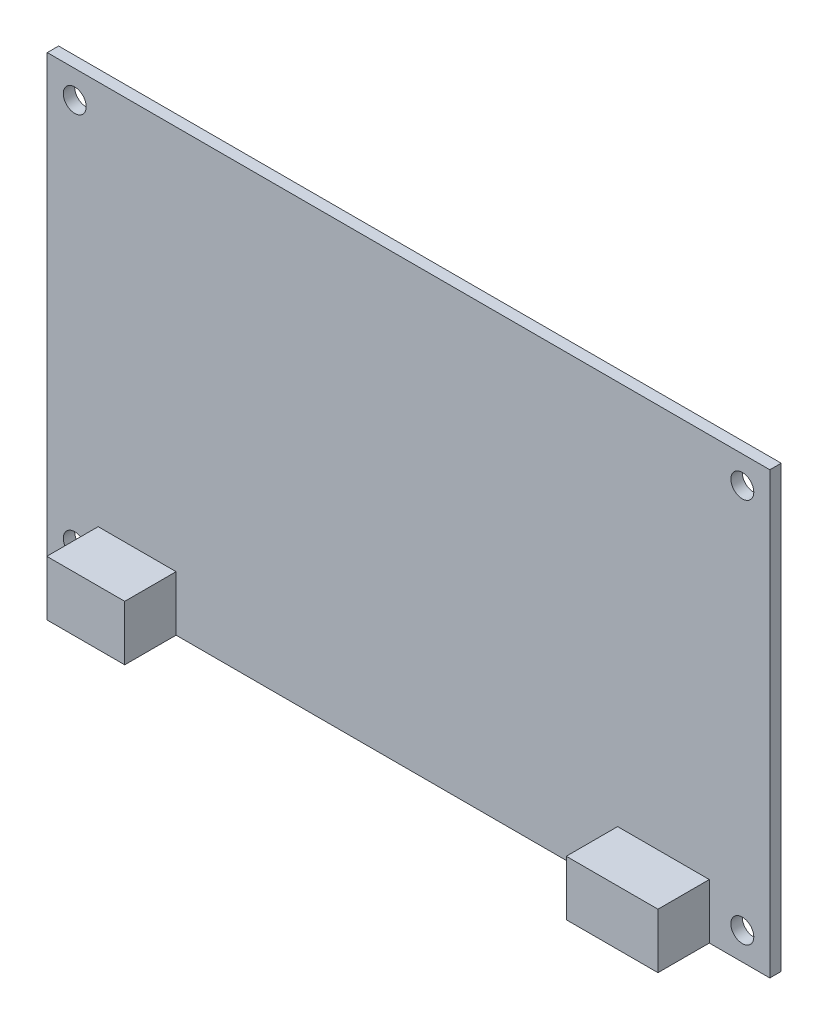
from build123d import *

# Parameters (mm, degrees)
SKETCH1_W           = 100.076
SKETCH1_H           = 60.96
SKETCH1_R           = 1.5875
BOSS_EXTRUDE1_DEPTH = 1.5748
SKETCH2_W           = 10.795
SKETCH2_H           = 7.62
SKETCH2_W_2         = 12.7
BOSS_EXTRUDE2_DEPTH = 7.112


with BuildPart() as part:
    # Sketch1 → Boss-Extrude1 (new body)
    with BuildSketch(Plane.XY):
        with Locations((50.038, 30.48)):
            Rectangle(SKETCH1_W, SKETCH1_H)
        with Locations((3.81, 57.15)):
            Circle(SKETCH1_R, mode=Mode.SUBTRACT)
        with Locations((96.266, 57.15)):
            Circle(SKETCH1_R, mode=Mode.SUBTRACT)
        with Locations((96.266, 3.81)):
            Circle(SKETCH1_R, mode=Mode.SUBTRACT)
        with Locations((3.81, 3.81)):
            Circle(SKETCH1_R, mode=Mode.SUBTRACT)
    extrude(amount=BOSS_EXTRUDE1_DEPTH)

    # Sketch2 → Boss-Extrude2 (add)
    with BuildSketch(Plane.XY.offset(1.5748)):
        with Locations((12.446, 3.81)):
            Rectangle(SKETCH2_W, SKETCH2_H)
        with Locations((85.344, 3.81)):
            Rectangle(SKETCH2_W_2, SKETCH2_H)
    extrude(amount=BOSS_EXTRUDE2_DEPTH)


solid = part.part
